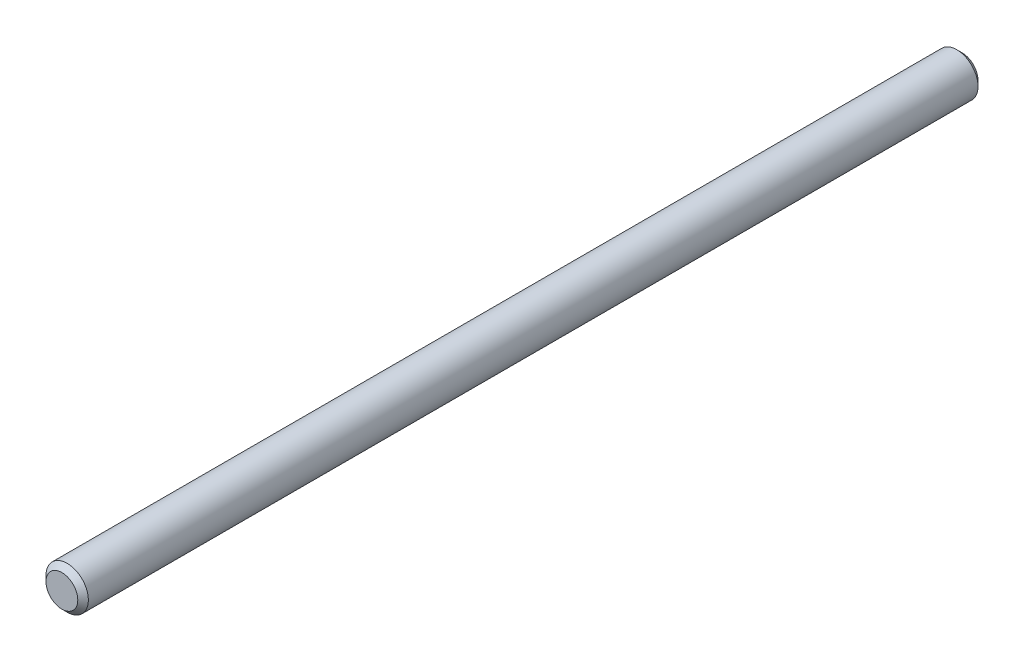
from build123d import *

# Parameters (mm, degrees)
ESBO_O1_R                = 4
RESSALTO_EXTRUS_O1_DEPTH = 85
CHANFRO1_SIZE            = 1


with BuildPart() as part:
    # Esboço1 → Ressalto-extrusão1 (new, symmetric)
    with BuildSketch(Plane.XY):
        with Locations((-40, -27)):
            Circle(ESBO_O1_R)
    extrude(amount=RESSALTO_EXTRUS_O1_DEPTH, both=True)

    # Chanfro1
    chanfro1_edges = [part.edges().sort_by_distance(p)[0] for p in [
        (-44, -27, -85),
        (-44, -27, 85),
    ]]
    chamfer(chanfro1_edges, length=CHANFRO1_SIZE)


solid = part.part
